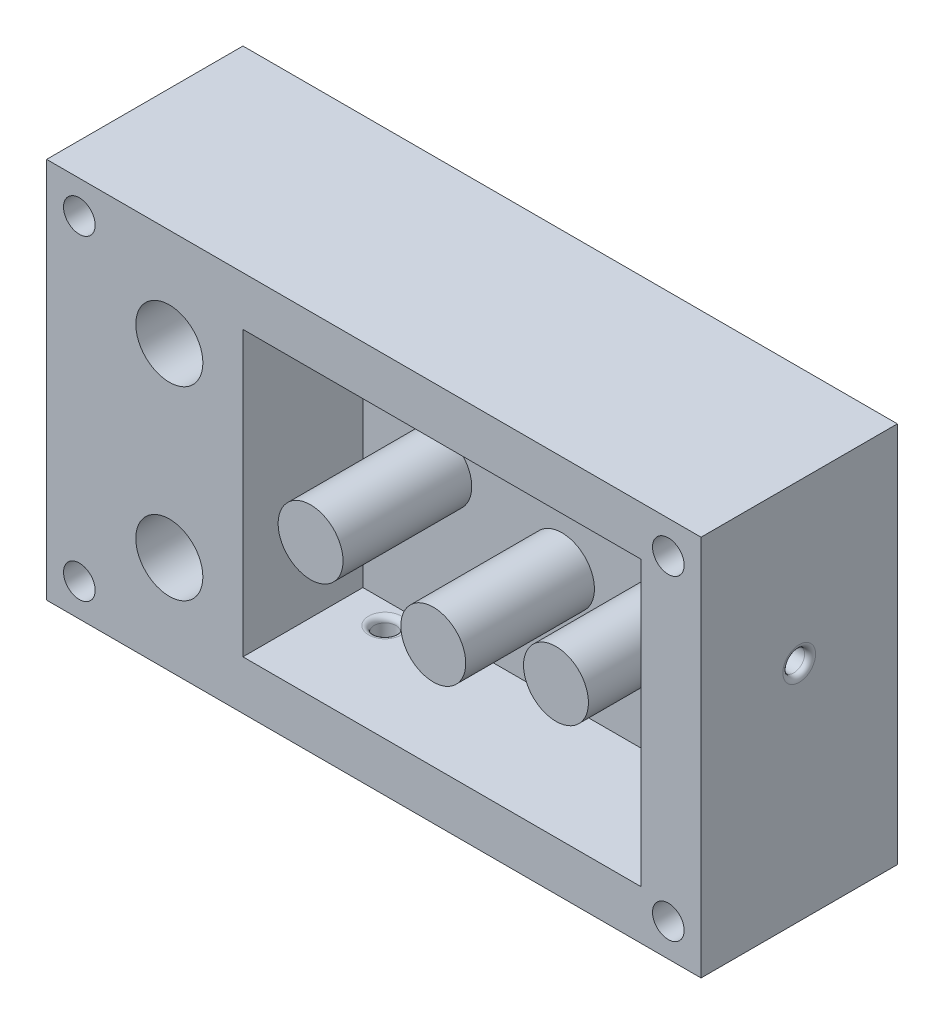
from build123d import *

# Parameters (mm, degrees)
SKETCH1_W           = 60
SKETCH1_H           = 35
BOSS_EXTRUDE1_DEPTH = 18
SKETCH2_R           = 3.075
CUT_EXTRUDE1_DEPTH  = 18
SKETCH3_R           = 1.45
SKETCH3_W           = 36.5
SKETCH3_H           = 26
CUT_EXTRUDE2_DEPTH  = 11
SKETCH4_R           = 2.975
BOSS_EXTRUDE2_DEPTH = 11.8
SKETCH6_R           = 1
CUT_EXTRUDE3_DEPTH  = 5.8
SKETCH8_R           = 1
CUT_EXTRUDE4_DEPTH  = 5.8
FILLET2_R           = 0.5


with BuildPart() as part:
    # Sketch1 → Boss-Extrude1 (new body)
    with BuildSketch(Plane.XY):
        with Locations((30, 17.5)):
            Rectangle(SKETCH1_W, SKETCH1_H)
    extrude(amount=BOSS_EXTRUDE1_DEPTH)

    # Sketch2 → Cut-Extrude1 (cut)
    with BuildSketch(Plane.XY.offset(18)):
        with Locations((11.25, 26)):
            Circle(SKETCH2_R)
        with Locations((11.25, 9)):
            Circle(SKETCH2_R)
    extrude(amount=-CUT_EXTRUDE1_DEPTH, mode=Mode.SUBTRACT)

    # Sketch3 → Cut-Extrude2 (cut)
    with BuildSketch(Plane.XY.offset(18)):
        with Locations((3, 32)):
            Circle(SKETCH3_R)
        with Locations((57, 32)):
            Circle(SKETCH3_R)
        with Locations((57, 3)):
            Circle(SKETCH3_R)
        with Locations((3, 3)):
            Circle(SKETCH3_R)
        with Locations((36.25, 17.5)):
            Rectangle(SKETCH3_W, SKETCH3_H)
    extrude(amount=-CUT_EXTRUDE2_DEPTH, mode=Mode.SUBTRACT)

    # Sketch4 → Boss-Extrude2 (add)
    with BuildSketch(Plane.XY.offset(7)):
        with Locations(Location((25, 17.5, 0), (0, 0, 180))):
            Circle(SKETCH4_R)
        with Locations(Location((36.25, 15, 0), (0, 0, 180))):
            Circle(SKETCH4_R)
        with Locations(Location((47.5, 17.5, 0), (0, 0, 180))):
            Circle(SKETCH4_R)
    extrude(amount=BOSS_EXTRUDE2_DEPTH)

    # Sketch6 → Cut-Extrude3 (cut)
    with BuildSketch(Plane(origin=(60, 0, 0), x_dir=(0, 0, -1), z_dir=(1, 0, 0))):
        with Locations((-9, 20.475)):
            Circle(SKETCH6_R)
    extrude(amount=-CUT_EXTRUDE3_DEPTH, mode=Mode.SUBTRACT)

    # Sketch8 → Cut-Extrude4 (cut)
    with BuildSketch(Plane.XZ):
        with Locations(Location((22.025, 9, 0), (0, 0, 270))):
            Circle(SKETCH8_R)
    extrude(amount=-CUT_EXTRUDE4_DEPTH, mode=Mode.SUBTRACT)

    # Fillet2
    fillet2_edges = [part.edges().sort_by_distance(p)[0] for p in [
        (54.5, 20.475, 10),
        (60, 20.475, 10),
        (22.025, 4.5, 10),
        (22.025, 0, 10),
    ]]
    fillet(fillet2_edges, radius=FILLET2_R)


solid = part.part
